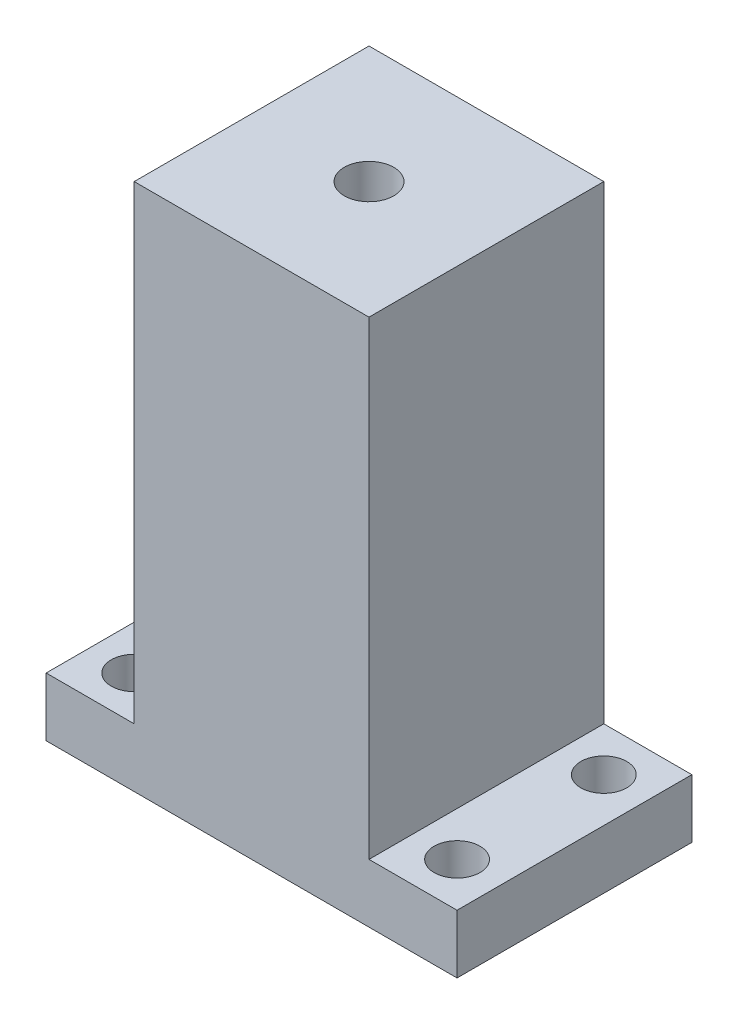
from build123d import *

# Parameters (mm, degrees)
SKETCH1_W           = 88.9
SKETCH1_H           = 50.8
BOSS_EXTRUDE1_DEPTH = 114.3
SKETCH2_OUTSIDE_W   = 121.59
SKETCH2_OUTSIDE_H   = 83.49
SKETCH2_OUTSIDE_W_2 = 50.8
SKETCH2_OUTSIDE_H_2 = 50.8
CUT_EXTRUDE1_DEPTH  = 101.6
SKETCH3_R           = 4.9609375
CUT_EXTRUDE2_DEPTH  = 114.769602707
SKETCH4_R           = 5.3578125
CUT_EXTRUDE3_DEPTH  = 41.275
SKETCH5_R           = 2.54
CUT_EXTRUDE4_DEPTH  = 2.54


with BuildPart() as part:
    # Sketch1 → Boss-Extrude1 (new body)
    with BuildSketch(Plane(origin=(0, 0, 0), x_dir=(1, 0, 0), z_dir=(0, 1, 0))):
        Rectangle(SKETCH1_W, SKETCH1_H)
    extrude(amount=BOSS_EXTRUDE1_DEPTH)

    # Sketch2 outside → Cut-Extrude1 (cut)
    with BuildSketch(Plane(origin=(0, 114.3, 0), x_dir=(1, 0, 0), z_dir=(0, 1, 0))):
        Rectangle(SKETCH2_OUTSIDE_W, SKETCH2_OUTSIDE_H)
        Rectangle(SKETCH2_OUTSIDE_W_2, SKETCH2_OUTSIDE_H_2, mode=Mode.SUBTRACT)
    extrude(amount=-CUT_EXTRUDE1_DEPTH, mode=Mode.SUBTRACT)

    # Sketch3 → Cut-Extrude2 (cut, through all)
    with BuildSketch(Plane(origin=(0, 12.7, 0), x_dir=(1, 0, 0), z_dir=(0, 1, 0))):
        with Locations(Location((-34.925, 15.875, 0), (0, 0, 270))):
            Circle(SKETCH3_R)
        with Locations(Location((-34.925, -15.875, 0), (0, 0, 270))):
            Circle(SKETCH3_R)
        with Locations(Location((34.925, -15.875, 0), (0, 0, 270))):
            Circle(SKETCH3_R)
        with Locations(Location((34.925, 15.875, 0), (0, 0, 270))):
            Circle(SKETCH3_R)
    extrude(amount=-CUT_EXTRUDE2_DEPTH, mode=Mode.SUBTRACT)

    # Sketch4 → Cut-Extrude3 (cut)
    with BuildSketch(Plane(origin=(0, 114.3, 0), x_dir=(1, 0, 0), z_dir=(0, 1, 0))):
        with Locations(Location((0, 0, 0), (0, 0, 270))):
            Circle(SKETCH4_R)
    extrude(amount=-CUT_EXTRUDE3_DEPTH, mode=Mode.SUBTRACT)

    # Sketch5 → Cut-Extrude4 (cut)
    with BuildSketch(Plane.XZ):
        with Locations(Location((0, 0, 0), (0, 0, 270))):
            Circle(SKETCH5_R)
    extrude(amount=-CUT_EXTRUDE4_DEPTH, mode=Mode.SUBTRACT)


solid = part.part
